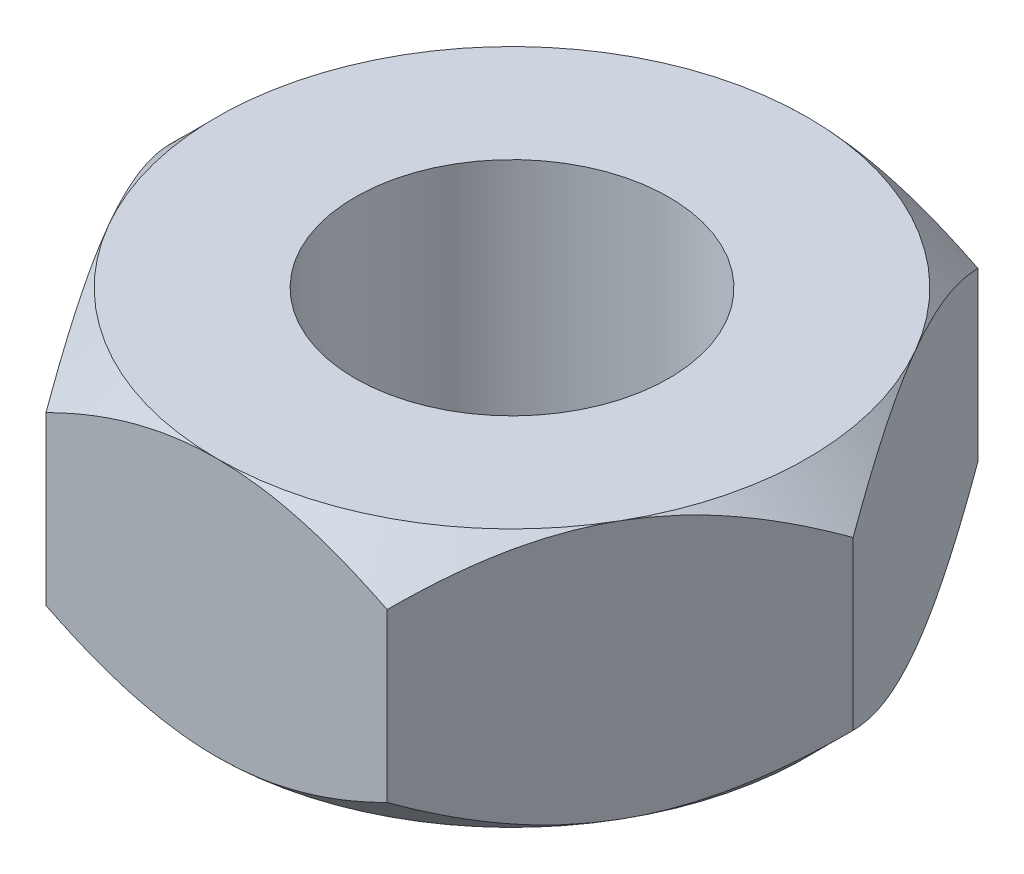
from build123d import *

# Parameters (mm, degrees)
EXTRUDE1_DEPTH                   = 5.6
SKETCH3_R                        = 12.424094019
SKETCH3_R_2                      = 6.4
EXTRUDE3_DEPTH                   = 6.1
EXTRUDE3_TAPER                   = 45
SKETCH4_R                        = 12.424094019
SKETCH4_R_2                      = 6.4
EXTRUDE4_DEPTH                   = 6.1
EXTRUDE4_DRAFT                   = -45
TAP_DRILL_FOR_M8X1_25_TAP1_D     = 6.8
TAP_DRILL_FOR_M8X1_25_TAP1_DEPTH = 10
TAP_DRILL_FOR_M8X1_25_TAP1_TIP   = 2.042926105


with BuildPart() as part:
    # Sketch1 → Extrude1 (new body)
    with BuildSketch(Plane(origin=(0, 0, 0), x_dir=(1, 0, 0), z_dir=(0, 1, 0))):
        Polygon((7.390083446, 0), (3.695041723, 6.4), (-3.695041723, 6.4), (-7.390083446, 0), (-3.695041723, -6.4), (3.695041723, -6.4), align=None)
    extrude(amount=EXTRUDE1_DEPTH)

    # Sketch3 → Extrude3 (cut)
    with BuildSketch(Plane(origin=(0, 5.6, 0), x_dir=(1, 0, 0), z_dir=(0, 1, 0))):
        Circle(SKETCH3_R)
        Circle(SKETCH3_R_2, mode=Mode.SUBTRACT)
    extrude(amount=-EXTRUDE3_DEPTH, taper=EXTRUDE3_TAPER, mode=Mode.SUBTRACT)


with BuildPart() as extrude4_tool:
    # Sketch4 → Extrude4 (with draft: the straight prism first)
    with BuildSketch(Plane.XZ):
        Circle(SKETCH4_R)
        Circle(SKETCH4_R_2, mode=Mode.SUBTRACT)
    extrude(amount=-EXTRUDE4_DEPTH)
    # Extrude4: the draft: its side faces are tilted about the plane it starts from
    extrude4_sides = [extrude4_tool.faces().sort_by_distance(p)[0] for p in [
        (-12.424094019, 3.05, 0),
        (-6.4, 3.05, 0),
    ]]
    draft(extrude4_sides, Plane.XZ, EXTRUDE4_DRAFT)


with BuildPart() as part_1:
    add(part.part)

    # Extrude4: cut by extrude4_tool
    add(extrude4_tool.part, mode=Mode.SUBTRACT)

    # Tap Drill for M8x1.25 Tap1
    with Locations(Plane.ZX.offset(5.6)):
        with Locations((0, 0)):
            Hole(TAP_DRILL_FOR_M8X1_25_TAP1_D / 2, depth=TAP_DRILL_FOR_M8X1_25_TAP1_DEPTH)
            with Locations((0, 0, -(TAP_DRILL_FOR_M8X1_25_TAP1_DEPTH + TAP_DRILL_FOR_M8X1_25_TAP1_TIP / 2))):  # 118° drill point
                Cone(0, TAP_DRILL_FOR_M8X1_25_TAP1_D / 2, TAP_DRILL_FOR_M8X1_25_TAP1_TIP, mode=Mode.SUBTRACT)


solid = part_1.part
